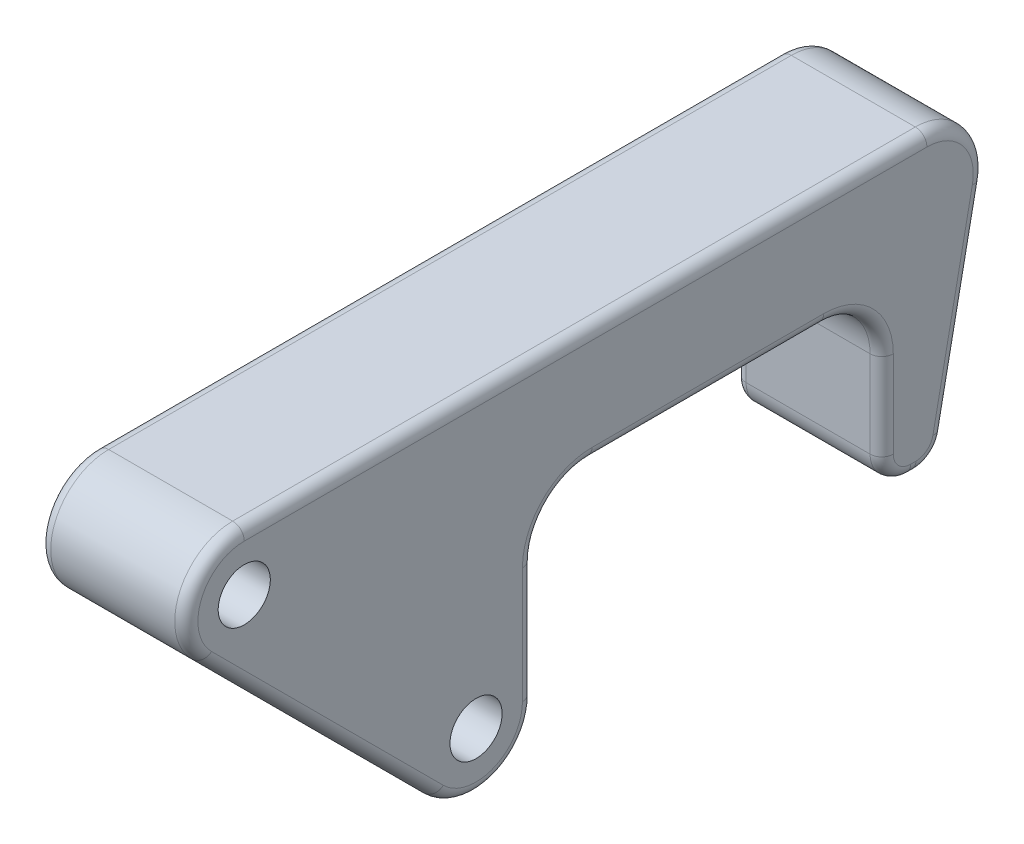
from build123d import *

# Parameters (mm, degrees)
SKETCH1_R           = 2.25
BOSS_EXTRUDE1_DEPTH = 12.7
FILLET1_R           = 5
FILLET2_R           = 2.5
FILLET3_R           = 1


with BuildPart() as part:
    # Sketch1 → Boss-Extrude1 (new body)
    with BuildSketch(Plane(origin=(0, 0, 0), x_dir=(0, 0, -1), z_dir=(1, 0, 0))):
        with BuildLine():
            Line((65, 5), (0, 5))
            ThreePointArc((0, 5), (-4.619397663, 1.913417162), (-3.535533906, -3.535533906))
            Line((-3.535533906, -3.535533906), (16.464466094, -23.535533906))
            ThreePointArc((16.464466094, -23.535533906), (21.913417162, -24.619397663), (25, -20))
            Line((25, -20), (25, -5))
            Line((25, -5), (55, -5))
            Line((55, -5), (55, -20))
            Line((55, -20), (60, -20))
            Line((60, -20), (65, 5))
        make_face()
        Circle(SKETCH1_R, mode=Mode.SUBTRACT)
        with Locations((20, -20)):
            Circle(SKETCH1_R, mode=Mode.SUBTRACT)
    extrude(amount=BOSS_EXTRUDE1_DEPTH)

    # Fillet1
    fillet1_edges = [part.edges().sort_by_distance(p)[0] for p in [
        (6.35, 5, -65),
        (6.35, -5, -55),
        (6.35, -5, -25),
    ]]
    fillet(fillet1_edges, radius=FILLET1_R)

    # Fillet2
    fillet2_edges = [part.edges().sort_by_distance(p)[0] for p in [
        (6.35, -20, -60),
        (6.35, -20, -55),
    ]]
    fillet(fillet2_edges, radius=FILLET2_R)

    # Fillet3
    fillet3_edges = [part.edges().sort_by_distance(p)[0] for p in [
        (12.7, 1.913417162, 4.619397663),
        (0, 5, -29.450490243),
        (0, -24.619397663, -21.913417162),
        (12.7, -13.535533906, -6.464466094),
        (0, -13.535533906, -6.464466094),
        (0, 1.913417162, 4.619397663),
        (12.7, -24.619397663, -21.913417162),
        (0, -5, -40),
        (12.7, -5, -40),
        (0, -15, -25),
        (0, 3.169944528, -62.767691193),
        (12.7, -15, -25),
        (12.7, 3.169944528, -62.767691193),
        (0, -6.464466094, -53.535533906),
        (12.7, -6.464466094, -53.535533906),
        (0, -6.464466094, -26.464466094),
        (12.7, -6.464466094, -26.464466094),
        (12.7, 5, -29.450490243),
        (0, -9.485435507, -62.102912899),
        (12.7, -9.485435507, -62.102912899),
        (0, -20, -57.725245122),
        (0, -13.75, -55),
        (0, -19.267766953, -55.732233047),
        (0, -19.433355353, -59.535462507),
        (12.7, -20, -57.725245122),
        (12.7, -13.75, -55),
        (12.7, -19.267766953, -55.732233047),
        (12.7, -19.433355353, -59.535462507),
    ]]
    fillet(fillet3_edges, radius=FILLET3_R)


solid = part.part
